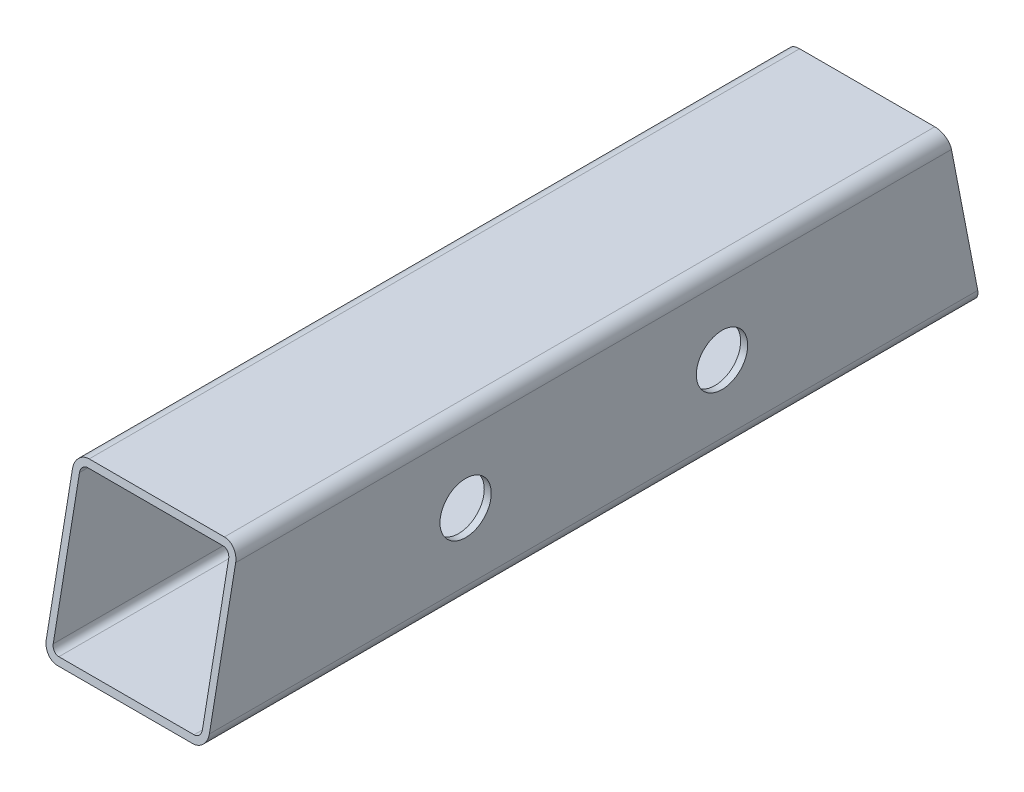
from build123d import *

# Parameters (mm, degrees)
BOSS_EXTRUDE1_DEPTH = 332
SKETCH2_R           = 7.5
CUT_EXTRUDE1_DEPTH  = 330
SKETCH3_R           = 11
CUT_EXTRUDE2_DEPTH  = 5


with BuildPart() as part:
    # Sketch1 → Boss-Extrude1 (new body)
    with BuildSketch(Plane.XY):
        with BuildLine():
            Line((22.479289941, 29.51183432), (-35.520710059, 29.51183432))
            ThreePointArc((-35.520710059, 29.51183432), (-39.763350746, 27.754475007), (-41.520710059, 23.51183432))
            Line((-41.520710059, 23.51183432), (-41.520710059, -34.48816568))
            ThreePointArc((-41.520710059, -34.48816568), (-39.763350746, -38.730806368), (-35.520710059, -40.48816568))
            Line((-35.520710059, -40.48816568), (22.479289941, -40.48816568))
            ThreePointArc((22.479289941, -40.48816568), (26.721930628, -38.730806368), (28.479289941, -34.48816568))
            Line((28.479289941, -34.48816568), (28.479289941, 23.51183432))
            ThreePointArc((28.479289941, 23.51183432), (26.721930628, 27.754475007), (22.479289941, 29.51183432))
        make_face()
        with BuildLine():
            Line((22.479289941, 26.51183432), (-35.520710059, 26.51183432))
            ThreePointArc((-35.520710059, 26.51183432), (-37.642030403, 25.633154663), (-38.520710059, 23.51183432))
            Line((-38.520710059, 23.51183432), (-38.520710059, -34.48816568))
            ThreePointArc((-38.520710059, -34.48816568), (-37.642030403, -36.609486024), (-35.520710059, -37.48816568))
            Line((-35.520710059, -37.48816568), (22.479289941, -37.48816568))
            ThreePointArc((22.479289941, -37.48816568), (24.600610284, -36.609486024), (25.479289941, -34.48816568))
            Line((25.479289941, -34.48816568), (25.479289941, 23.51183432))
            ThreePointArc((25.479289941, 23.51183432), (24.600610284, 25.633154663), (22.479289941, 26.51183432))
        make_face(mode=Mode.SUBTRACT)
    extrude(amount=BOSS_EXTRUDE1_DEPTH)

    # Sketch2 → Cut-Extrude1 (cut)
    with BuildSketch(Plane(origin=(28.479289941, 0, 0), x_dir=(0, 0, -1), z_dir=(1, 0, 0))):
        with Locations(Location((-220.9, -5.48816568, 0), (0, 0, 90))):
            Circle(SKETCH2_R)
        with Locations(Location((-110.9, -5.48816568, 0), (0, 0, 90))):
            Circle(SKETCH2_R)
        Polygon((0, -40.48816568), (-13.6, 29.51183432), (0, 29.51183432), align=None)
        Polygon((-332, -40.48816568), (-332, 29.51183432), (-318.4, 29.51183432), align=None)
    extrude(amount=-CUT_EXTRUDE1_DEPTH, mode=Mode.SUBTRACT)

    # Sketch3 → Cut-Extrude2 (cut)
    with BuildSketch(Plane(origin=(28.479289941, 0, 0), x_dir=(0, 0, -1), z_dir=(1, 0, 0))):
        with Locations(Location((-220.9, -5.48816568, 0), (0, 0, 90))):
            Circle(SKETCH3_R)
        with Locations(Location((-110.9, -5.48816568, 0), (0, 0, 90))):
            Circle(SKETCH3_R)
    extrude(amount=-CUT_EXTRUDE2_DEPTH, mode=Mode.SUBTRACT)


solid = part.part
